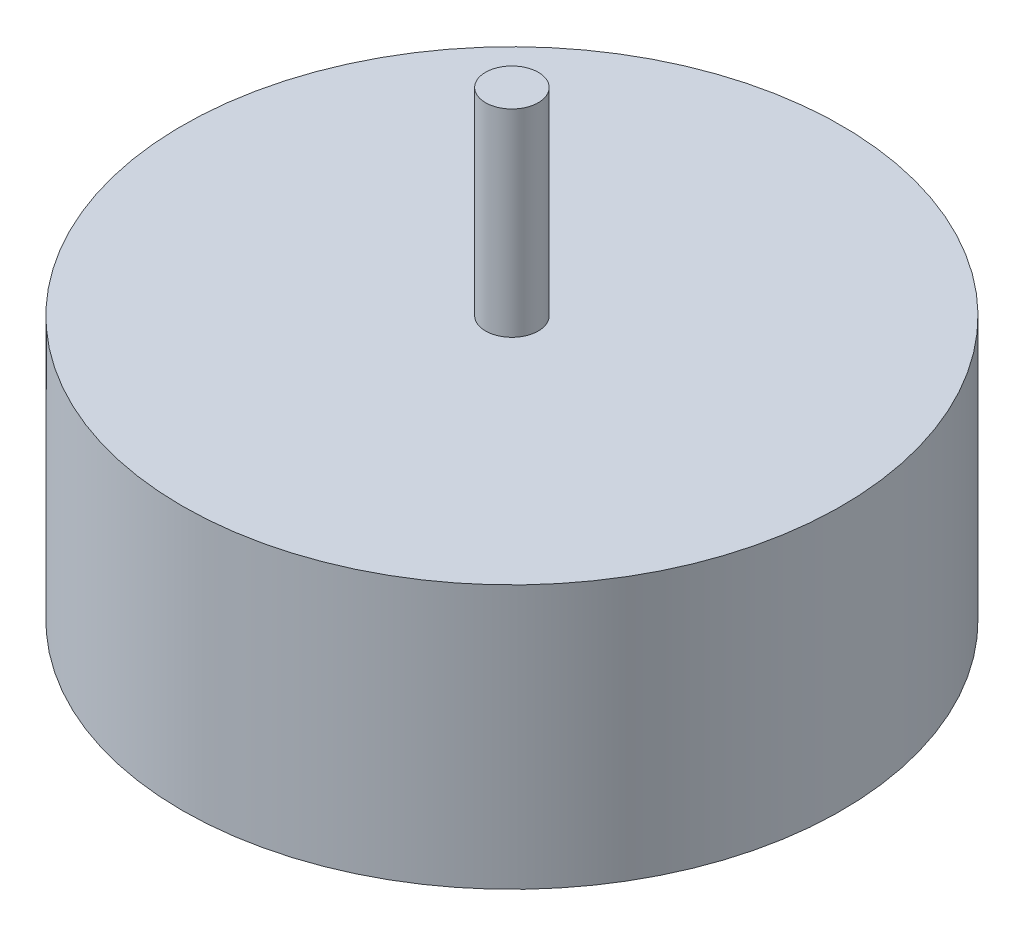
from build123d import *


with BuildPart() as part:
    # Sketch1 → Revolve3 (revolve)
    with BuildSketch(Plane.XY, mode=Mode.PRIVATE) as revolve3_sk:
        Polygon((0, 50), (0, 0), (50, 0), (50, 20), (4, 20), (4, 50), align=None)
        Polygon((50, 0), (0, 0), (0, -50), (4, -50), (4, -20), (50, -20), align=None)
    revolve(revolve3_sk.sketch.rotate(Axis((0, 50, 0), (0, -1, 0)), 90), axis=Axis((0, 50, 0), (0, -1, 0)))


solid = part.part
